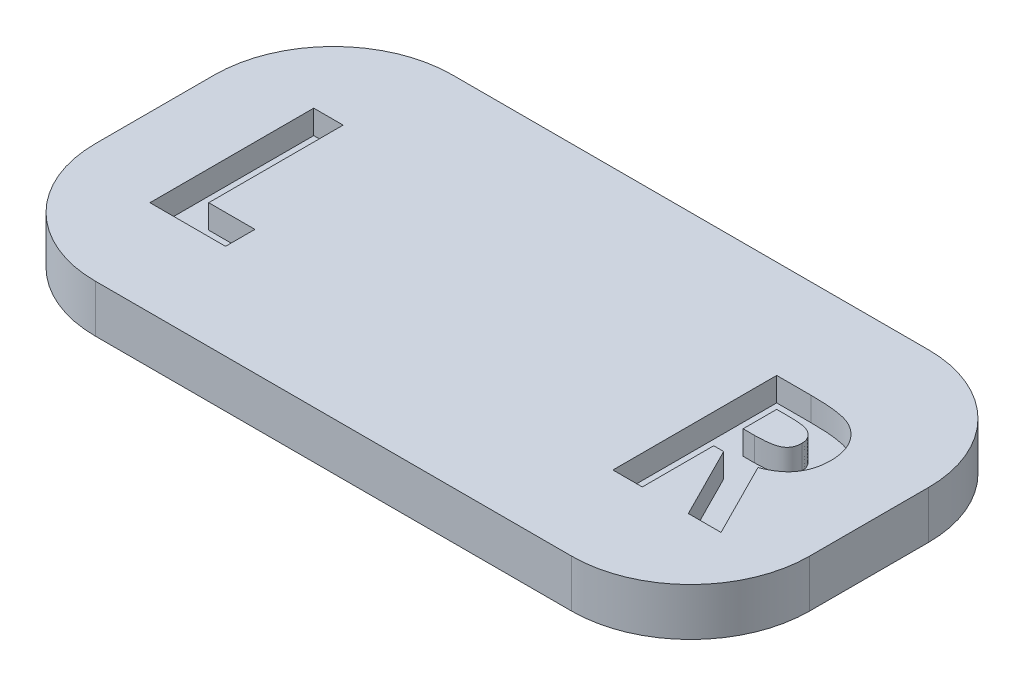
from build123d import *

# Parameters (mm, degrees)
SKETCH1_W           = 30
SKETCH1_H           = 15
BOSS_EXTRUDE1_DEPTH = 2
FILLET1_R           = 5
CUT_EXTRUDE1_DEPTH  = 1


with BuildPart() as part:
    # Sketch1 → Boss-Extrude1 (new body)
    with BuildSketch(Plane(origin=(0, 0, 0), x_dir=(1, 0, 0), z_dir=(0, 1, 0))):
        Rectangle(SKETCH1_W, SKETCH1_H)
    extrude(amount=BOSS_EXTRUDE1_DEPTH)

    # Fillet1
    fillet1_edges = [part.edges().sort_by_distance(p)[0] for p in [
        (-15, 1, -7.5),
        (15, 1, -7.5),
        (15, 1, 7.5),
        (-15, 1, 7.5),
    ]]
    fillet(fillet1_edges, radius=FILLET1_R)

    # Sketch3 → Cut-Extrude1 (cut)
    # profile 1 of 2: a face of its own
    with BuildSketch(Plane(origin=(0, 2, 0), x_dir=(1, 0, 0), z_dir=(0, 1, 0))):
        Polygon((-11.70625, 3.379166667), (-10.471527778, 3.379166667), (-10.471527778, -2.265277778), (-8.53125, -2.265277778), (-8.53125, -3.5), (-11.70625, -3.5), align=None)
    # profile 2 of 2: a face of its own
    with BuildSketch(Plane(origin=(0, 2, 0), x_dir=(1, 0, 0), z_dir=(0, 1, 0))):
        with BuildLine():
            Line((7.7375, 3.379166667), (9.176171875, 3.379166667))
            add(Edge.make_bspline(
                [(9.176171875, 3.379166667), (9.271267648, 3.378829131), (9.454163607, 3.378179956), (9.717889589, 3.367937683), (9.960158173, 3.35368472), (10.181328057, 3.33193432), (10.381304623, 3.303095918), (10.560288293, 3.269100215), (10.718273835, 3.230354823), (10.856593641, 3.182075007), (10.981420425, 3.127616107), (11.097776343, 3.065041832), (11.208228378, 2.995048967), (11.312038278, 2.91579581), (11.410108175, 2.828708105), (11.502623084, 2.733698191), (11.588275684, 2.629960422), (11.666535611, 2.51815029), (11.737863234, 2.400528594), (11.800901893, 2.276933841), (11.852165035, 2.147280077), (11.897461517, 2.01344108), (11.930087105, 1.873503596), (11.952777724, 1.728829939), (11.969390908, 1.578910842), (11.970346086, 1.477062464), (11.970833333, 1.425108507)],
                knots=[0, 0, 0, 0, 1.749336639, 3.364467119, 4.854658419, 6.213483162, 7.451590619, 8.570285859, 9.5643256, 10.440900261, 11.26203566, 12.067320669, 12.869050712, 13.665104639, 14.467235401, 15.27997916, 16.102287765, 16.939272006, 17.78853747, 18.631303466, 19.488103222, 20.351255419, 21.228522269, 22.127379805, 23.044756219, 24, 24, 24, 24], degree=3))
            add(Edge.make_bspline(
                [(11.970833333, 1.425108507), (11.969567641, 1.370880511), (11.967085849, 1.264549293), (11.953717567, 1.108357407), (11.929284548, 0.958923936), (11.892277185, 0.816686402), (11.849742029, 0.679874494), (11.793181181, 0.551012476), (11.729346675, 0.428226238), (11.653532296, 0.313252637), (11.57032972, 0.203537881), (11.473566874, 0.103285547), (11.369512504, 0.007107453), (11.252317335, -0.078972131), (11.12714744, -0.160773597), (10.991515824, -0.234907509), (10.846307665, -0.303237424), (10.744219138, -0.341342904), (10.692013889, -0.360828993)],
                knots=[0, 0, 0, 0, 1.099860209, 2.156625411, 3.176576793, 4.16617041, 5.135385252, 6.078461593, 7.016046972, 7.938469504, 8.868247731, 9.803980173, 10.76021508, 11.73834243, 12.748633912, 13.790971185, 14.870363756, 16, 16, 16, 16], degree=3))
            Line((10.692013889, -0.360828993), (12.279513889, -3.5))
            Line((12.279513889, -3.5), (10.906987847, -3.5))
            Line((10.906987847, -3.5), (9.391145833, -0.501388889))
            Line((9.391145833, -0.501388889), (8.972222222, -0.501388889))
            Line((8.972222222, -0.501388889), (8.972222222, -3.5))
            Line((8.972222222, -3.5), (7.7375, -3.5))
            Line((7.7375, -3.5), (7.7375, 3.379166667))
        make_face()
        with BuildLine():
            Line((8.972222222, 0.733333333), (9.453157552, 0.733333333))
            add(Edge.make_bspline(
                [(9.453157552, 0.733333333), (9.511955894, 0.73399556), (9.624542084, 0.735263581), (9.786455813, 0.74114519), (9.933512094, 0.75531696), (10.066342435, 0.773222462), (10.185615227, 0.793896951), (10.290266598, 0.823524747), (10.381909067, 0.855271682), (10.459456666, 0.894724886), (10.525711554, 0.939591736), (10.582918408, 0.990561593), (10.630236679, 1.049552713), (10.66918203, 1.11496197), (10.699477279, 1.187367895), (10.721590489, 1.265975634), (10.733948504, 1.35168063), (10.735370336, 1.410828747), (10.736111111, 1.441644965)],
                knots=[0, 0, 0, 0, 1.688639943, 3.233382647, 4.650958383, 5.928841754, 7.082724185, 8.122798841, 9.049171256, 9.863274652, 10.613301712, 11.341792392, 12.054588806, 12.776240173, 13.521029143, 14.301969904, 15.115324896, 16, 16, 16, 16], degree=3))
            add(Edge.make_bspline(
                [(10.736111111, 1.441644965), (10.734710607, 1.478102802), (10.731959577, 1.549717465), (10.704660808, 1.652817469), (10.661207064, 1.748243577), (10.601643884, 1.835564629), (10.526631801, 1.912116292), (10.440549519, 1.979597192), (10.341539172, 2.032956039), (10.249863042, 2.068150966), (10.166459192, 2.089208454), (10.091189849, 2.104900308), (10.004027496, 2.116021575), (9.904906331, 2.127817658), (9.794079017, 2.135466821), (9.670941479, 2.141049186), (9.535847367, 2.143333205), (9.44167394, 2.144063366), (9.392523872, 2.144444444)],
                knots=[0, 0, 0, 0, 1.020303359, 2.004196876, 2.966617323, 3.9489082, 4.950758222, 5.960522915, 7.003732012, 8.091992268, 8.70421221, 9.413913587, 10.24622431, 11.166358409, 12.212345909, 13.359657661, 14.621978493, 16, 16, 16, 16], degree=3))
            Line((9.392523872, 2.144444444), (8.972222222, 2.144444444))
            Line((8.972222222, 2.144444444), (8.972222222, 0.733333333))
        make_face(mode=Mode.SUBTRACT)
    extrude(amount=-CUT_EXTRUDE1_DEPTH, mode=Mode.SUBTRACT)


solid = part.part
